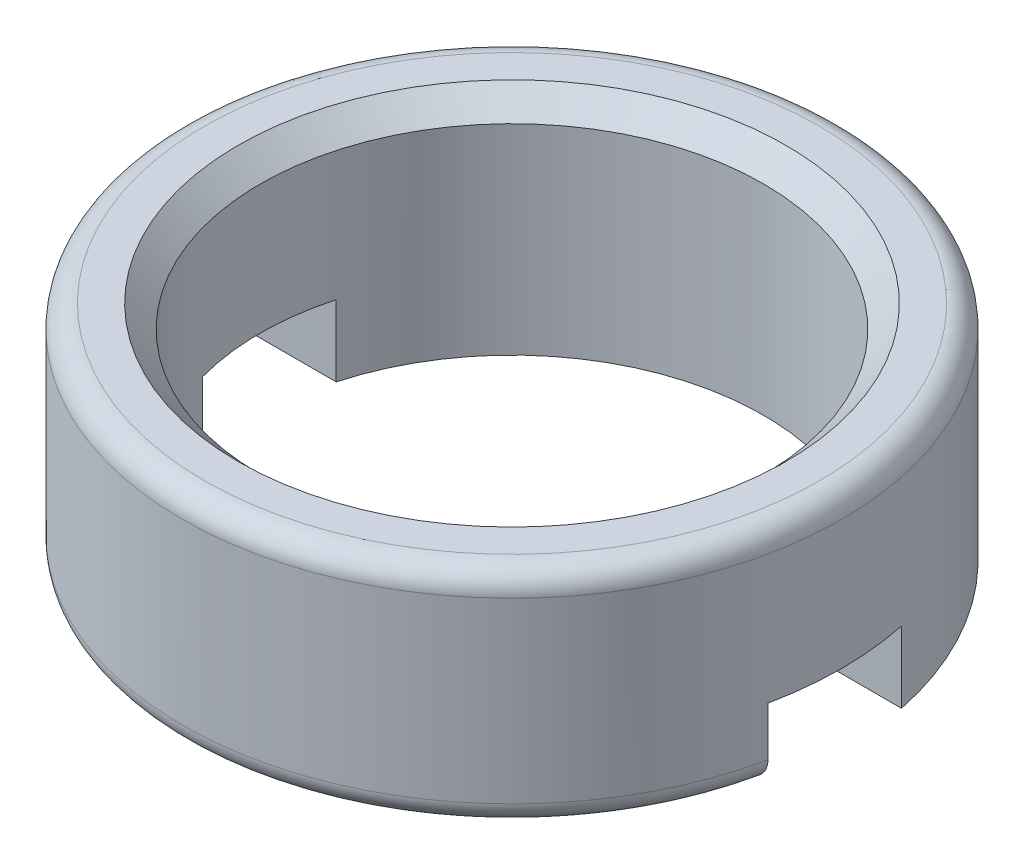
from build123d import *

# Parameters (mm, degrees)
SKETCH1_R           = 7.4
SKETCH1_R_2         = 5.65
BOSS_EXTRUDE1_DEPTH = 5
SKETCH2_W           = 27.497480526
SKETCH2_H           = 3
CUT_EXTRUDE2_DEPTH  = 1.6
FILLET1_R           = 0.5
CHAMFER1_SIZE       = 0.5


with BuildPart() as part:
    # Sketch1 → Boss-Extrude1 (new body)
    with BuildSketch(Plane(origin=(0, 0, 0), x_dir=(1, 0, 0), z_dir=(0, 1, 0))):
        with Locations(Location((0, 0, 0), (0, 0, 270))):
            Circle(SKETCH1_R)
        with Locations(Location((0, 0, 0), (0, 0, 270))):
            Circle(SKETCH1_R_2, mode=Mode.SUBTRACT)
    extrude(amount=BOSS_EXTRUDE1_DEPTH)

    # Sketch2 → Cut-Extrude2 (cut)
    with BuildSketch(Plane(origin=(0, 0, 0), x_dir=(1, 0, 0), z_dir=(0, 1, 0))):
        Rectangle(SKETCH2_W, SKETCH2_H)
    extrude(amount=CUT_EXTRUDE2_DEPTH, mode=Mode.SUBTRACT)

    # Fillet1
    fillet1_edges = [part.edges().sort_by_distance(p)[0] for p in [
        (-3.423996203, 0, 4.494301948),
        (4.672258554, 0, 5.738466694),
        (0, 5, -7.4),
    ]]
    fillet(fillet1_edges, radius=FILLET1_R)

    # Chamfer1
    chamfer1_edges = [part.edges().sort_by_distance(p)[0] for p in [
        (0, 5, -5.65),
    ]]
    chamfer(chamfer1_edges, length=CHAMFER1_SIZE)


solid = part.part
